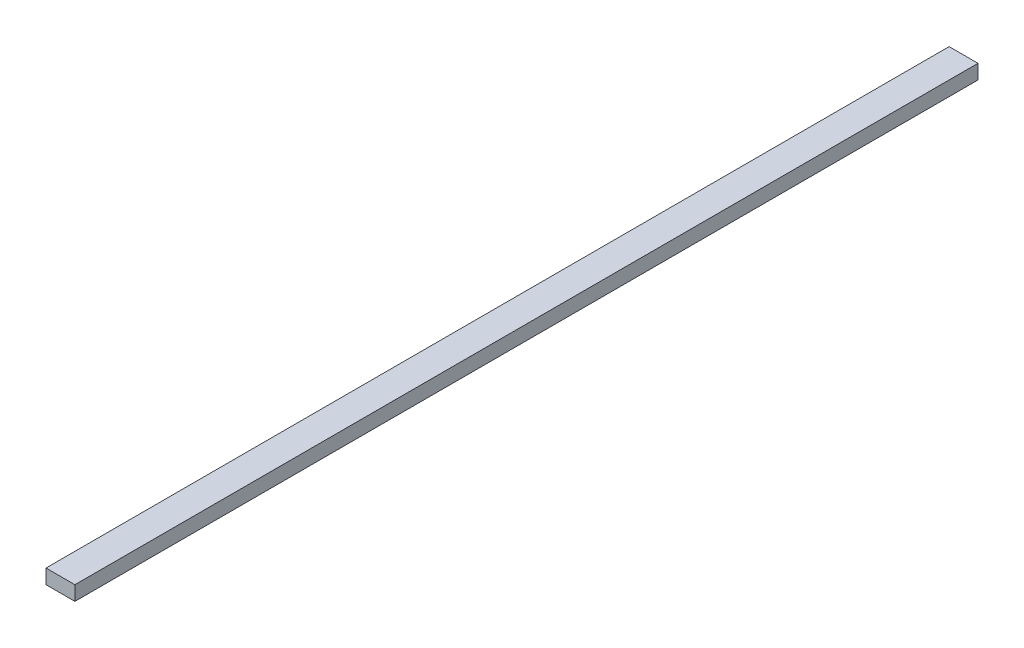
from build123d import *

# Parameters (mm, degrees)
SKETCH1_W           = 40
SKETCH1_H           = 20
BOSS_EXTRUDE1_DEPTH = 1250


with BuildPart() as part:
    # Sketch1 → Boss-Extrude1 (new body)
    with BuildSketch(Plane.XY):
        Rectangle(SKETCH1_W, SKETCH1_H)
    extrude(amount=BOSS_EXTRUDE1_DEPTH)


solid = part.part
